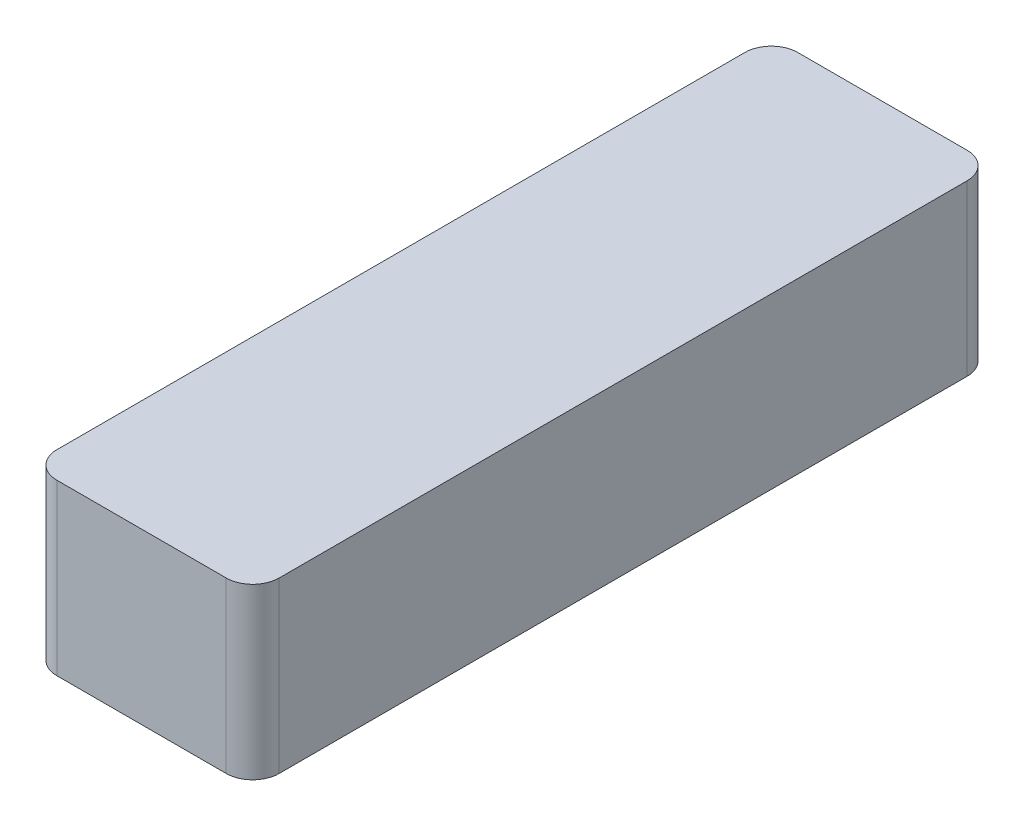
from build123d import *

# Parameters (mm, degrees)
IZIM1_W                     = 42
IZIM1_H                     = 32
Y_KSEKLIK_EKSTR_ZYON1_DEPTH = 140
RADYUS1_R                   = 5


with BuildPart() as part:
    # Çizim1 → Yükseklik-Ekstrüzyon1 (new body)
    with BuildSketch(Plane.XY):
        Rectangle(IZIM1_W, IZIM1_H)
    extrude(amount=Y_KSEKLIK_EKSTR_ZYON1_DEPTH)

    # Radyus1
    radyus1_edges = [part.edges().sort_by_distance(p)[0] for p in [
        (-21, 0, 140),
        (21, 0, 140),
        (-21, 0, 0),
        (21, 0, 0),
    ]]
    fillet(radyus1_edges, radius=RADYUS1_R)


solid = part.part
